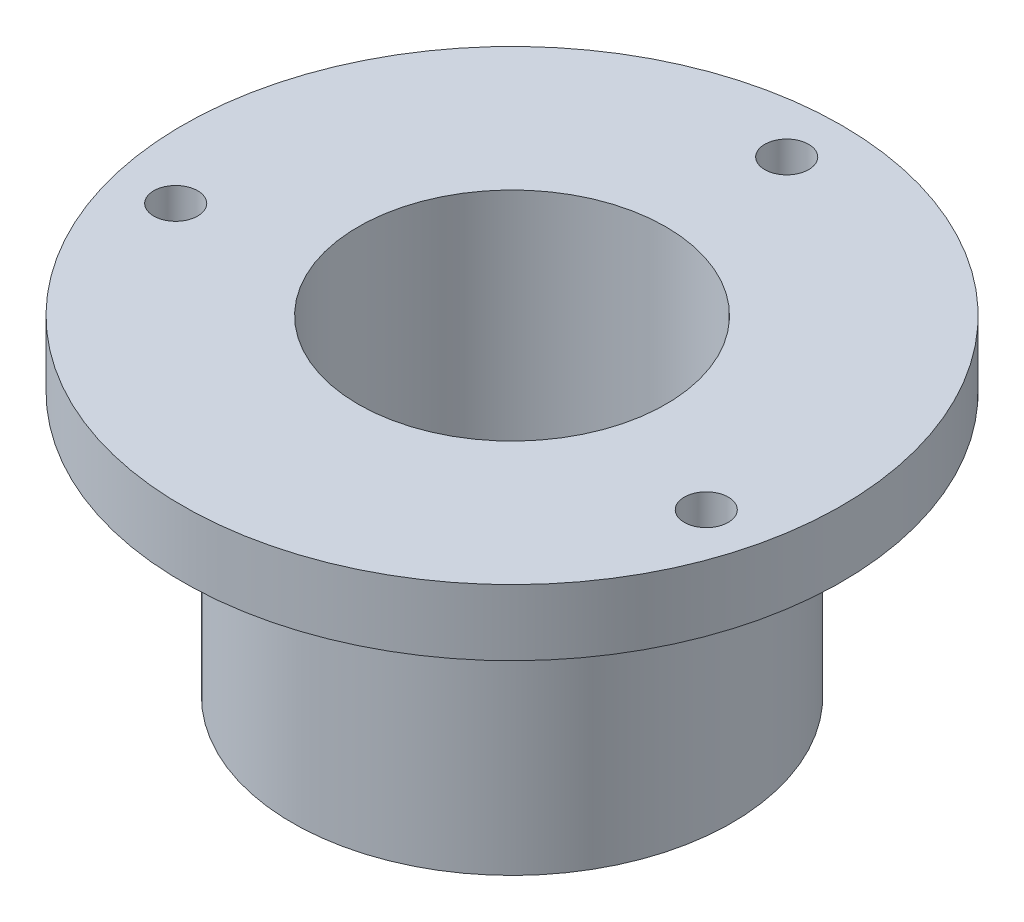
from build123d import *

# Parameters (mm, degrees)
SKETCH2_R          = 1
CUT_EXTRUDE1_DEPTH = 26.980762114
SKETCH3_R          = 0.8
CUT_EXTRUDE2_DEPTH = 2.5


with BuildPart() as part:
    # Sketch1 → Revolve1 (revolve)
    with BuildSketch(Plane.XY, mode=Mode.PRIVATE) as revolve1_sk:
        Polygon((10, 0), (10, 12), (15, 12), (15, 15), (7, 15), (7, 0), align=None)
    revolve(revolve1_sk.sketch.rotate(Axis((0, 0, 0), (0, 1, 0)), 90), axis=Axis((0, 0, 0), (0, 1, 0)))

    # Sketch2 → Cut-Extrude1 (cut, through all)
    with BuildSketch(Plane(origin=(0, 15, 0), x_dir=(1, 0, 0), z_dir=(0, 1, 0))):
        with Locations(Location((0, 12.5, 0), (0, 0, 270))):
            Circle(SKETCH2_R)
        with Locations(Location((-12.074072829, -3.235238064, 0), (0, 0, 270))):
            Circle(SKETCH2_R)
        with Locations(Location((12.074072829, -3.235238064, 0), (0, 0, 270))):
            Circle(SKETCH2_R)
    extrude(amount=-CUT_EXTRUDE1_DEPTH, mode=Mode.SUBTRACT)

    # Sketch3 → Cut-Extrude2 (cut)
    with BuildSketch(Plane.XZ):
        with Locations(Location((0, 8.5, 0), (0, 0, 270))):
            Circle(SKETCH3_R)
        with Locations(Location((7.361215932, -4.25, 0), (0, 0, 270))):
            Circle(SKETCH3_R)
        with Locations(Location((-7.361215932, -4.25, 0), (0, 0, 270))):
            Circle(SKETCH3_R)
    extrude(amount=-CUT_EXTRUDE2_DEPTH, mode=Mode.SUBTRACT)


solid = part.part
